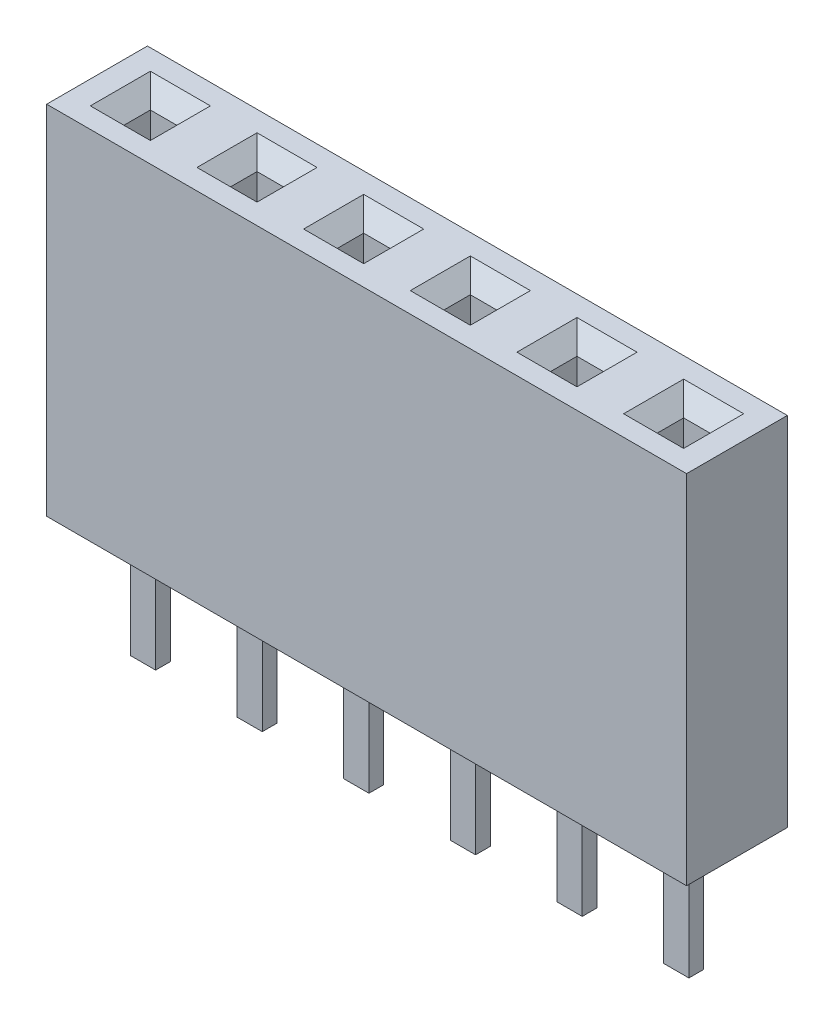
from build123d import *

# Parameters (mm, degrees)
SKETCH1_W           = 38.1
SKETCH1_H           = 2.4
BOSS_EXTRUDE1_DEPTH = 8.5
SKETCH2_W           = 0.63
SKETCH2_H           = 0.63
CUT_EXTRUDE1_DEPTH  = 6.5
SKETCH3_W           = 0.6
SKETCH3_H           = 0.35
BOSS_EXTRUDE2_DEPTH = 2.9
CHAMFER1_SIZE       = 0.4
SKETCH4_W           = 19.378829163
SKETCH4_H           = 4.471478983
CUT_EXTRUDE2_DEPTH  = 23.232914789
SKETCH8_W           = 10.16
SKETCH8_H           = 13.150882218
CUT_EXTRUDE3_DEPTH  = 21.997916563


with BuildPart() as part:
    # Sketch1 → Boss-Extrude1 (new body)
    with BuildSketch(Plane(origin=(0, 0, 0), x_dir=(1, 0, 0), z_dir=(0, 1, 0))):
        Rectangle(SKETCH1_W, SKETCH1_H)
    extrude(amount=BOSS_EXTRUDE1_DEPTH)

    # Sketch2 → Cut-Extrude1 (cut)
    with BuildSketch(Plane(origin=(0, 8.5, 0), x_dir=(1, 0, 0), z_dir=(0, 1, 0))):
        with Locations((-15.24, 0)):
            Rectangle(SKETCH2_W, SKETCH2_H)
        with Locations((-17.78, 0)):
            Rectangle(SKETCH2_W, SKETCH2_H)
        with Locations((-12.7, 0)):
            Rectangle(SKETCH2_W, SKETCH2_H)
        with Locations((-10.16, 0)):
            Rectangle(SKETCH2_W, SKETCH2_H)
        with Locations((-7.62, 0)):
            Rectangle(SKETCH2_W, SKETCH2_H)
        with Locations((-5.08, 0)):
            Rectangle(SKETCH2_W, SKETCH2_H)
        with Locations((-2.54, 0)):
            Rectangle(SKETCH2_W, SKETCH2_H)
        Rectangle(SKETCH2_W, SKETCH2_H)
        with Locations((2.54, 0)):
            Rectangle(SKETCH2_W, SKETCH2_H)
        with Locations((5.08, 0)):
            Rectangle(SKETCH2_W, SKETCH2_H)
        with Locations((7.62, 0)):
            Rectangle(SKETCH2_W, SKETCH2_H)
        with Locations((10.16, 0)):
            Rectangle(SKETCH2_W, SKETCH2_H)
        with Locations((12.7, 0)):
            Rectangle(SKETCH2_W, SKETCH2_H)
        with Locations((15.24, 0)):
            Rectangle(SKETCH2_W, SKETCH2_H)
        with Locations((17.78, 0)):
            Rectangle(SKETCH2_W, SKETCH2_H)
    extrude(amount=-CUT_EXTRUDE1_DEPTH, mode=Mode.SUBTRACT)

    # Sketch3 → Boss-Extrude2 (add)
    with BuildSketch(Plane.XZ):
        with Locations((-15.24, 0)):
            Rectangle(SKETCH3_W, SKETCH3_H)
        with Locations((-17.78, 0)):
            Rectangle(SKETCH3_W, SKETCH3_H)
        with Locations((-12.7, 0)):
            Rectangle(SKETCH3_W, SKETCH3_H)
        with Locations((-10.16, 0)):
            Rectangle(SKETCH3_W, SKETCH3_H)
        with Locations((-7.62, 0)):
            Rectangle(SKETCH3_W, SKETCH3_H)
        with Locations((-5.08, 0)):
            Rectangle(SKETCH3_W, SKETCH3_H)
        with Locations((-2.54, 0)):
            Rectangle(SKETCH3_W, SKETCH3_H)
        Rectangle(SKETCH3_W, SKETCH3_H)
        with Locations((2.54, 0)):
            Rectangle(SKETCH3_W, SKETCH3_H)
        with Locations((5.08, 0)):
            Rectangle(SKETCH3_W, SKETCH3_H)
        with Locations((7.62, 0)):
            Rectangle(SKETCH3_W, SKETCH3_H)
        with Locations((10.16, 0)):
            Rectangle(SKETCH3_W, SKETCH3_H)
        with Locations((12.7, 0)):
            Rectangle(SKETCH3_W, SKETCH3_H)
        with Locations((15.24, 0)):
            Rectangle(SKETCH3_W, SKETCH3_H)
        with Locations((17.78, 0)):
            Rectangle(SKETCH3_W, SKETCH3_H)
    extrude(amount=BOSS_EXTRUDE2_DEPTH)

    # Chamfer1
    chamfer1_edges = [part.edges().sort_by_distance(p)[0] for p in [
        (2.855, 8.5, 0),
        (2.54, 8.5, -0.315),
        (2.225, 8.5, 0),
        (2.54, 8.5, 0.315),
        (5.395, 8.5, 0),
        (5.08, 8.5, -0.315),
        (4.765, 8.5, 0),
        (5.08, 8.5, 0.315),
        (7.935, 8.5, 0),
        (7.62, 8.5, -0.315),
        (7.305, 8.5, 0),
        (7.62, 8.5, 0.315),
        (10.475, 8.5, 0),
        (10.16, 8.5, -0.315),
        (9.845, 8.5, 0),
        (10.16, 8.5, 0.315),
        (13.015, 8.5, 0),
        (12.7, 8.5, -0.315),
        (12.385, 8.5, 0),
        (12.7, 8.5, 0.315),
        (15.555, 8.5, 0),
        (15.24, 8.5, -0.315),
        (14.925, 8.5, 0),
        (15.24, 8.5, 0.315),
        (18.095, 8.5, 0),
        (17.78, 8.5, -0.315),
        (17.465, 8.5, 0),
        (17.78, 8.5, 0.315),
        (-17.465, 8.5, 0),
        (-17.78, 8.5, -0.315),
        (-18.095, 8.5, 0),
        (-17.78, 8.5, 0.315),
        (-14.925, 8.5, 0),
        (-15.24, 8.5, -0.315),
        (-15.555, 8.5, 0),
        (-15.24, 8.5, 0.315),
        (-12.385, 8.5, 0),
        (-12.7, 8.5, -0.315),
        (-13.015, 8.5, 0),
        (-12.7, 8.5, 0.315),
        (-9.845, 8.5, 0),
        (-10.16, 8.5, -0.315),
        (-10.475, 8.5, 0),
        (-10.16, 8.5, 0.315),
        (-7.305, 8.5, 0),
        (-7.62, 8.5, -0.315),
        (-7.935, 8.5, 0),
        (-7.62, 8.5, 0.315),
        (-4.765, 8.5, 0),
        (-5.08, 8.5, -0.315),
        (-5.395, 8.5, 0),
        (-5.08, 8.5, 0.315),
        (-2.225, 8.5, 0),
        (-2.54, 8.5, -0.315),
        (-2.855, 8.5, 0),
        (-2.54, 8.5, 0.315),
        (0.315, 8.5, 0),
        (0, 8.5, -0.315),
        (-0.315, 8.5, 0),
        (0, 8.5, 0.315),
    ]]
    chamfer(chamfer1_edges, length=CHAMFER1_SIZE)

    # Sketch4 → Cut-Extrude2 (cut, through all)
    with BuildSketch(Plane(origin=(0, 8.5, 0), x_dir=(1, 0, 0), z_dir=(0, 1, 0))):
        with Locations((16.039414582, -0.096925096)):
            Rectangle(SKETCH4_W, SKETCH4_H)
    extrude(amount=-CUT_EXTRUDE2_DEPTH, mode=Mode.SUBTRACT)

    # Sketch8 → Cut-Extrude3 (cut, through all)
    with BuildSketch(Plane.XY.offset(1.2)):
        with Locations((-13.97, 1.924558891)):
            Rectangle(SKETCH8_W, SKETCH8_H)
    extrude(amount=-CUT_EXTRUDE3_DEPTH, mode=Mode.SUBTRACT)


solid = part.part
